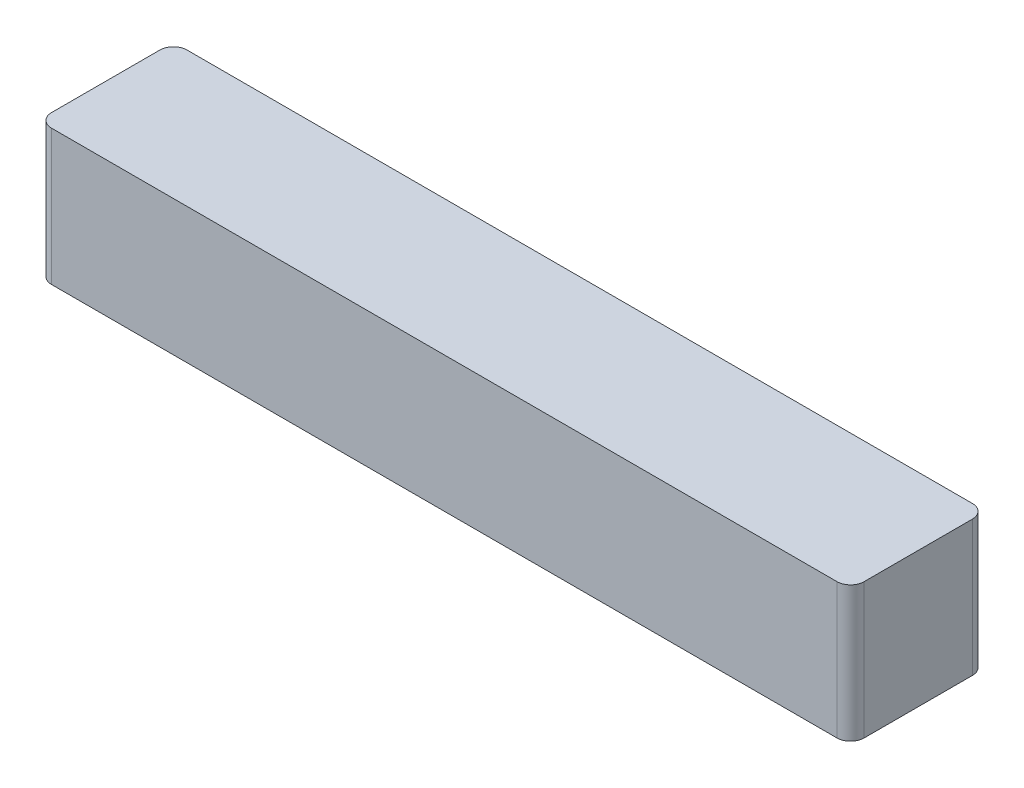
from build123d import *

# Parameters (mm, degrees)
SKETCH1_W           = 38.1
SKETCH1_H           = 6.35
BOSS_EXTRUDE1_DEPTH = 6.35
SKETCH2_R           = 2.4003
CUT_EXTRUDE1_DEPTH  = 8.89
FILLET1_R           = 0.635
SKETCH3_R           = 0.889
CUT_EXTRUDE2_DEPTH  = 3.81


with BuildPart() as part:
    # Sketch1 → Boss-Extrude1 (new body)
    with BuildSketch(Plane(origin=(0, 0, 0), x_dir=(1, 0, 0), z_dir=(0, 1, 0))):
        with Locations((19.05, 3.175)):
            Rectangle(SKETCH1_W, SKETCH1_H)
    extrude(amount=BOSS_EXTRUDE1_DEPTH)

    # Sketch2 → Cut-Extrude1 (cut)
    with BuildSketch(Plane.ZY):
        with Locations((-3.175, 3.175)):
            Circle(SKETCH2_R)
    extrude(amount=-CUT_EXTRUDE1_DEPTH, mode=Mode.SUBTRACT)

    # Fillet1
    fillet1_edges = [part.edges().sort_by_distance(p)[0] for p in [
        (0, 3.175, -6.35),
        (38.1, 3.175, -6.35),
        (38.1, 3.175, 0),
        (0, 3.175, 0),
    ]]
    fillet(fillet1_edges, radius=FILLET1_R)

    # Sketch3 → Cut-Extrude2 (cut)
    with BuildSketch(Plane.XZ):
        with Locations(Location((11.43, -3.175, 0), (0, 0, 270))):
            Circle(SKETCH3_R)
        with Locations(Location((26.67, -3.175, 0), (0, 0, 270))):
            Circle(SKETCH3_R)
    extrude(amount=-CUT_EXTRUDE2_DEPTH, mode=Mode.SUBTRACT)


solid = part.part
